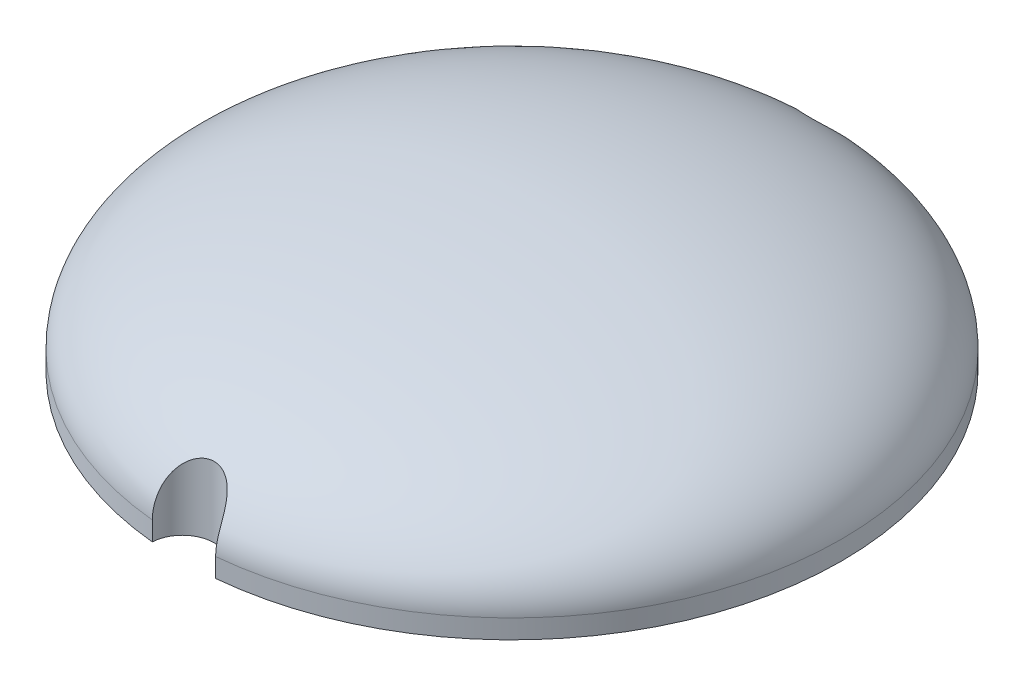
from build123d import *

# Parameters (mm, degrees)
SKETCH89_R          = 26
SKETCH89_R_2        = 24
BOSS_EXTRUDE1_DEPTH = 1.5
BOSS_EXTRUDE2_REACH = 40.38
SKETCH93_R          = 2.5
CUT_EXTRUDE6_DEPTH  = 39.379682289


with BuildPart() as part:
    # Sketch89 → Boss-Extrude1 (new body)
    with BuildSketch(Plane(origin=(0, 0, 0), x_dir=(1, 0, 0), z_dir=(0, 1, 0))):
        with Locations(Location((0, 0, 0), (0, 0, 270))):
            Circle(SKETCH89_R)
        with Locations(Location((0, 0, 0), (0, 0, 270))):
            Circle(SKETCH89_R_2, mode=Mode.SUBTRACT)
    extrude(amount=BOSS_EXTRUDE1_DEPTH)

    # Sketch92 → Revolve1 (revolve)
    with BuildSketch(Plane(origin=(0, 0, 2.878275232), x_dir=(0, 0, 1), z_dir=(-1, 0, 0))):
        with BuildLine():
            Line((-2.878275232, 9.5), (-2.878275232, 11))
            add(Edge.make_bspline(
                [(23.121724768, 1.5), (23.121724768, 11), (-2.878275232, 11)],
                knots=[3.141592654, 3.141592654, 3.141592654, 4.71238898, 4.71238898, 4.71238898], degree=2, weights=[1, 0.707106781, 1]))
            Line((23.121724768, 1.5), (21.121724768, 1.5))
            add(Edge.make_bspline(
                [(21.121724768, 1.5), (21.121724768, 9.5), (-2.878275232, 9.5)],
                knots=[3.141592654, 3.141592654, 3.141592654, 4.71238898, 4.71238898, 4.71238898], degree=2, weights=[1, 0.707106781, 1]))
        make_face()
    revolve(axis=Axis((0, 14.26487872, 0), (0, -1, 0)))

    # Sketch94 → Boss-Extrude2 (add, up to next)
    with BuildSketch(Plane(origin=(0, 0, 0), x_dir=(1, 0, 0), z_dir=(0, 1, 0)), mode=Mode.PRIVATE) as boss_extrude2_sk1:
        with BuildLine():
            ThreePointArc((-3.988148122, 25.692307692), (0, 22), (3.988148122, 25.692307692))
            ThreePointArc((3.988148122, 25.692307692), (0, 26), (-3.988148122, 25.692307692))
        make_face()
    boss_extrude2_tool1 = extrude(boss_extrude2_sk1.sketch, amount=BOSS_EXTRUDE2_REACH, mode=Mode.PRIVATE) - part.part
    # Sketch94 → Boss-Extrude2 (add, up to next)
    with BuildSketch(Plane(origin=(0, 0, 0), x_dir=(1, 0, 0), z_dir=(0, 1, 0)), mode=Mode.PRIVATE) as boss_extrude2_sk2:
        with BuildLine():
            ThreePointArc((3.988148122, -25.692307692), (0, -22), (-3.988148122, -25.692307692))
            ThreePointArc((-3.988148122, -25.692307692), (0, -26), (3.988148122, -25.692307692))
        make_face()
    boss_extrude2_tool2 = extrude(boss_extrude2_sk2.sketch, amount=BOSS_EXTRUDE2_REACH, mode=Mode.PRIVATE) - part.part
    add(boss_extrude2_tool1.solids().sort_by_distance((0, 0, -24.248137))[0])
    add(boss_extrude2_tool2.solids().sort_by_distance((0, 0, 24.248137))[0])

    # Sketch93 → Cut-Extrude6 (cut, through all)
    with BuildSketch(Plane(origin=(0, 0, 0), x_dir=(1, 0, 0), z_dir=(0, 1, 0))):
        with Locations((0, 26)):
            Circle(SKETCH93_R)
        with Locations((0, -26)):
            Circle(SKETCH93_R)
    extrude(amount=CUT_EXTRUDE6_DEPTH, mode=Mode.SUBTRACT)


solid = part.part
